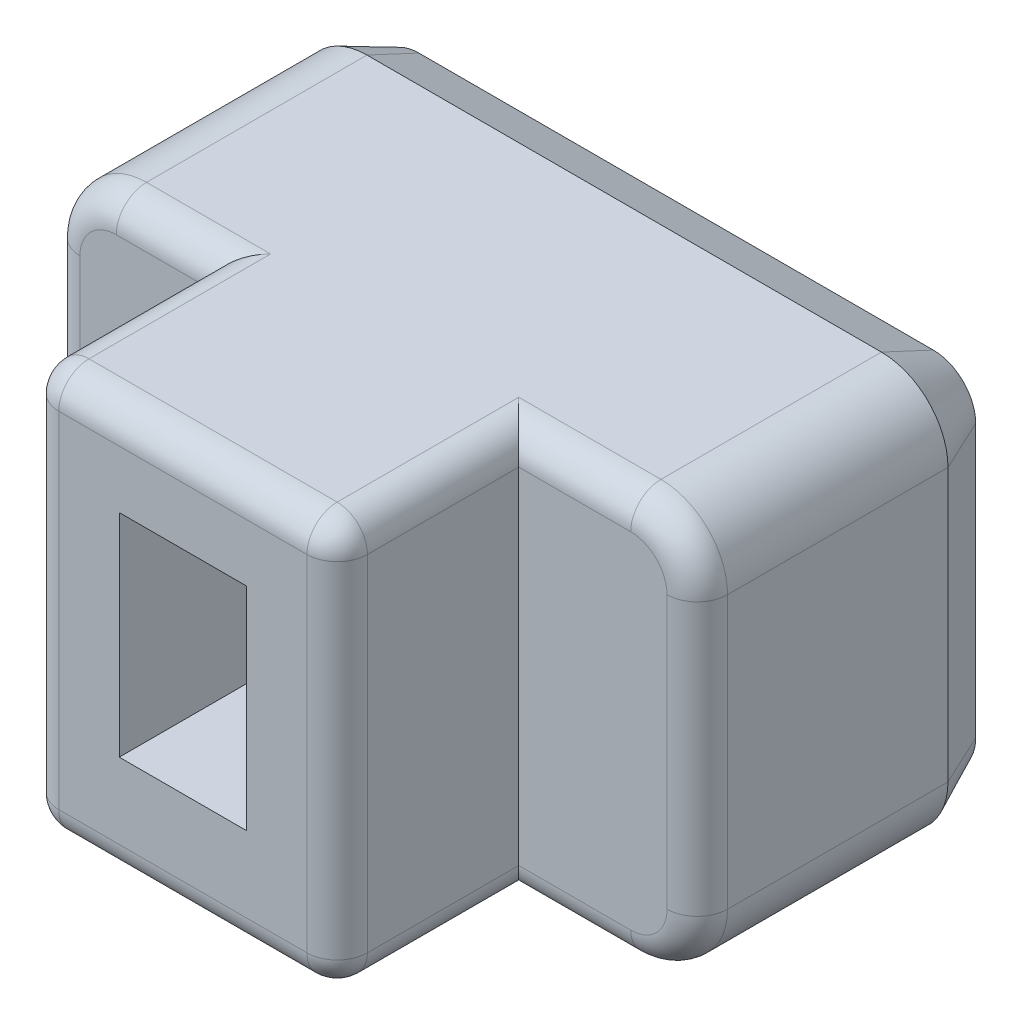
from build123d import *

# Parameters (mm, degrees)
BOSS_EXTRU_1_DEPTH      = 8
ESQUISSE3_W             = 2.1
ESQUISSE3_H             = 3.5
ENL_V_MAT_EXTRU_1_DEPTH = 3
ESQUISSE4_OUTSIDE_W     = 15.69
ESQUISSE4_OUTSIDE_H     = 11.69
ESQUISSE4_OUTSIDE_W_2   = 5.1
ESQUISSE4_OUTSIDE_H_2   = 6.7
ENL_V_MAT_EXTRU_2_DEPTH = 3
CONG_1_R                = 0.5
CHANFREIN1_SIZE         = 0.4
CHANFREIN1_SIZE2        = 0.857802768
ESQUISSE5_W             = 1.179487179
ESQUISSE5_H             = 0.41025641
ENL_V_MAT_EXTRU_3_DEPTH = 0.3
BOSS_EXTRU_2_START      = -0.2
BOSS_EXTRU_2_DEPTH      = 0.2
BOSS_EXTRU_2_2_DEPTH    = 0.2
ESQUISSE5_3_W           = 1.179487179
ESQUISSE5_3_H           = 0.41025641
BOSS_EXTRU_2_3_DEPTH    = 0.2


with BuildPart() as part:
    # Esquisse2 → Boss.-Extru.1 (new body)
    with BuildSketch(Plane.XY):
        with BuildLine():
            Line((1.1, 0), (9.6, 0))
            ThreePointArc((9.6, 0), (10.377817459, 0.322182541), (10.7, 1.1))
            Line((10.7, 1.1), (10.7, 5.6))
            ThreePointArc((10.7, 5.6), (10.377817459, 6.377817459), (9.6, 6.7))
            Line((9.6, 6.7), (1.1, 6.7))
            ThreePointArc((1.1, 6.7), (0.322182541, 6.377817459), (0, 5.6))
            Line((0, 5.6), (0, 1.1))
            ThreePointArc((0, 1.1), (0.322182541, 0.322182541), (1.1, 0))
        make_face()
    extrude(amount=BOSS_EXTRU_1_DEPTH)

    # Esquisse3 → Enlèv. mat.-Extru.1 (cut)
    with BuildSketch(Plane.XY.offset(8)):
        with Locations((5.2, 3.5)):
            Rectangle(ESQUISSE3_W, ESQUISSE3_H)
    extrude(amount=-ENL_V_MAT_EXTRU_1_DEPTH, mode=Mode.SUBTRACT)

    # Esquisse4 outside → Enlèv. mat.-Extru.2 (cut)
    with BuildSketch(Plane.XY.offset(8)):
        with Locations((5.35, 3.35)):
            Rectangle(ESQUISSE4_OUTSIDE_W, ESQUISSE4_OUTSIDE_H)
        with Locations((5.2, 3.35)):
            Rectangle(ESQUISSE4_OUTSIDE_W_2, ESQUISSE4_OUTSIDE_H_2, mode=Mode.SUBTRACT)
    extrude(amount=-ENL_V_MAT_EXTRU_2_DEPTH, mode=Mode.SUBTRACT)

    # Congé1
    cong_1_edges = [part.edges().sort_by_distance(p)[0] for p in [
        (8.675, 0, 5),
        (10.377817459, 0.322182541, 5),
        (10.7, 3.35, 5),
        (10.377817459, 6.377817459, 5),
        (1.875, 6.7, 5),
        (0.322182541, 6.377817459, 5),
        (1.875, 0, 5),
        (0.322182541, 0.322182541, 5),
        (7.75, 6.7, 6.5),
        (2.65, 6.7, 6.5),
        (7.75, 0, 6.5),
        (2.65, 0, 6.5),
        (2.65, 3.35, 8),
        (5.2, 6.7, 8),
        (7.75, 3.35, 8),
        (5.2, 0, 8),
        (8.675, 6.7, 5),
        (0, 3.35, 5),
    ]]
    fillet(cong_1_edges, radius=CONG_1_R)

    # Chanfrein1
    chanfrein1_edges = [part.edges().sort_by_distance(p)[0] for p in [
        (5.35, 0, 0),
        (10.377817459, 0.322182541, 0),
        (0.322182541, 0.322182541, 0),
        (10.7, 3.35, 0),
        (0, 3.35, 0),
        (10.377817459, 6.377817459, 0),
        (0.322182541, 6.377817459, 0),
        (5.35, 6.7, 0),
    ]]
    chanfrein1_side = [part.faces().sort_by_distance(p)[0] for p in [
        (5.35, 3.35, 0),
    ]]
    chamfer(chanfrein1_edges, length=CHANFREIN1_SIZE, length2=CHANFREIN1_SIZE2, reference=chanfrein1_side[0])

    # Esquisse5 → Enlèv. mat.-Extru.3 (cut)
    with BuildSketch(Plane.XY.offset(0.2)):
        Polygon((2.203105905, 1.356639893), (2.538041802, 1.356639893), (3.562080264, 4.427953995), (4.586118725, 1.356639893), (4.921054623, 1.356639893), (3.587721289, 5.356639893), (3.536439238, 5.356639893), align=None)
        with BuildLine():
            Line((5.126182828, 4.585005277), (5.38900334, 4.382280918))
            add(Edge.make_bspline(
                [(5.38900334, 4.382280918), (5.413090347, 4.434734124), (5.458847361, 4.534377142), (5.535673468, 4.670679709), (5.615678085, 4.785984982), (5.698107333, 4.881707379), (5.785033694, 4.955475471), (5.874475773, 5.00936547), (5.967884233, 5.042884236), (6.03190811, 5.046936478), (6.063682828, 5.048947585)],
                knots=[0, 0, 0, 0, 1.383800419, 2.628744027, 3.746436854, 4.744875104, 5.649467572, 6.46786177, 7.239607766, 8, 8, 8, 8], degree=3))
            add(Edge.make_bspline(
                [(6.063682828, 5.048947585), (6.090484232, 5.047915361), (6.144138999, 5.045848911), (6.2231394, 5.027605196), (6.29923293, 4.997330479), (6.371745345, 4.956651043), (6.438844589, 4.906290216), (6.499018233, 4.847465011), (6.549483208, 4.779569393), (6.590810957, 4.704944558), (6.623893696, 4.625687294), (6.646610538, 4.542959539), (6.662064747, 4.457906397), (6.663777523, 4.400245429), (6.664644366, 4.37106297)],
                knots=[0, 0, 0, 0, 0.957467278, 1.916790714, 2.8816612, 3.878022564, 4.880909137, 5.873739163, 6.876625736, 7.894321194, 8.917782173, 9.939815978, 10.957332139, 12, 12, 12, 12], degree=3))
            add(Edge.make_bspline(
                [(6.664644366, 4.37106297), (6.663116159, 4.33784798), (6.660045133, 4.271100414), (6.639283168, 4.171546978), (6.604732006, 4.072903182), (6.571727112, 4.0103738), (6.554868725, 3.978434764)],
                knots=[0, 0, 0, 0, 0.967036425, 1.943319252, 2.949479453, 4, 4, 4, 4], degree=3))
            add(Edge.make_bspline(
                [(6.554868725, 3.978434764), (6.541270867, 3.955544534), (6.512871237, 3.907737439), (6.462555159, 3.836879973), (6.405716133, 3.762024308), (6.34027677, 3.684373105), (6.267574529, 3.602645186), (6.186436737, 3.518095187), (6.098337308, 3.429587963), (6.035816293, 3.370878839), (6.003586674, 3.340614252)],
                knots=[0, 0, 0, 0, 0.755113658, 1.577082841, 2.46375137, 3.42141287, 4.457284934, 5.566821384, 6.745695014, 8, 8, 8, 8], degree=3))
            add(Edge.make_bspline(
                [(6.003586674, 3.340614252), (5.971383421, 3.310591476), (5.909614978, 3.253005365), (5.823584769, 3.168051464), (5.74630771, 3.090394511), (5.678749178, 3.019250278), (5.621397188, 2.954050532), (5.57160066, 2.896943255), (5.533217709, 2.844749229), (5.51173285, 2.811589806), (5.50198411, 2.796543739)],
                knots=[0, 0, 0, 0, 1.424520873, 2.732346164, 3.911797783, 4.969453705, 5.906063081, 6.721610001, 7.419931359, 8, 8, 8, 8], degree=3))
            add(Edge.make_bspline(
                [(5.50198411, 2.796543739), (5.475764473, 2.749380501), (5.423847512, 2.655993551), (5.370463251, 2.504916726), (5.336950757, 2.348246373), (5.333201387, 2.241425992), (5.331311033, 2.18756938)],
                knots=[0, 0, 0, 0, 1.009954538, 1.999790066, 2.991535804, 4, 4, 4, 4], degree=3))
            add(Edge.make_bspline(
                [(5.331311033, 2.18756938), (5.332565906, 2.145300123), (5.335040178, 2.061956491), (5.353892012, 1.939999856), (5.38417953, 1.823489004), (5.42729507, 1.714000288), (5.481866362, 1.613028432), (5.545701317, 1.521412424), (5.621269329, 1.442361638), (5.70512133, 1.374850896), (5.796225656, 1.321404354), (5.892026548, 1.28180717), (5.992382914, 1.259085711), (6.060636614, 1.25575128), (6.094932828, 1.25407579)],
                knots=[0, 0, 0, 0, 1.133761159, 2.235472776, 3.302779566, 4.358109397, 5.384199343, 6.376419921, 7.344643441, 8.308294326, 9.255929822, 10.168867226, 11.079889886, 12, 12, 12, 12], degree=3))
            add(Edge.make_bspline(
                [(6.094932828, 1.25407579), (6.131707349, 1.255659498), (6.204953393, 1.258813865), (6.312299116, 1.287922739), (6.416036266, 1.333017399), (6.4981574, 1.386290499), (6.562343254, 1.438686688), (6.611375583, 1.486881802), (6.661967328, 1.541794347), (6.711909756, 1.60583863), (6.764211933, 1.675872068), (6.816239425, 1.754194824), (6.869008346, 1.839799037), (6.903342656, 1.900068201), (6.921054623, 1.931159123)],
                knots=[0, 0, 0, 0, 1.174951508, 2.340222187, 3.534605894, 4.784307204, 5.458577557, 6.18406604, 6.982816435, 7.846623665, 8.781884822, 9.780080324, 10.854814883, 12, 12, 12, 12], degree=3))
            Line((6.921054623, 1.931159123), (6.668650776, 2.177152713))
            add(Edge.make_bspline(
                [(6.668650776, 2.177152713), (6.654201435, 2.151898252), (6.626391438, 2.103292126), (6.582472349, 2.035632698), (6.542393686, 1.973253591), (6.501535704, 1.919142288), (6.464668025, 1.869917096), (6.428269503, 1.828153302), (6.394233324, 1.792560002), (6.350737392, 1.755500881), (6.295622788, 1.719432878), (6.226757018, 1.687223386), (6.154433342, 1.668221522), (6.105188655, 1.665630625), (6.080509751, 1.6643322)],
                knots=[0, 0, 0, 0, 1.276827984, 2.457453407, 3.54024844, 4.529789216, 5.432604881, 6.238830133, 6.960111447, 7.592115036, 8.743207621, 9.839626427, 10.917331914, 12, 12, 12, 12], degree=3))
            add(Edge.make_bspline(
                [(6.080509751, 1.6643322), (6.049276014, 1.665746122), (5.988374155, 1.668503091), (5.902600694, 1.698267748), (5.825331953, 1.744298704), (5.759529383, 1.808773895), (5.706549611, 1.886571818), (5.665947342, 1.973399307), (5.643774522, 2.069762465), (5.640623659, 2.136449115), (5.63900334, 2.170742457)],
                knots=[0, 0, 0, 0, 0.995603803, 1.941302263, 2.868878109, 3.853865766, 4.861170307, 5.866733861, 6.902976476, 8, 8, 8, 8], degree=3))
            add(Edge.make_bspline(
                [(5.63900334, 2.170742457), (5.640870112, 2.213681361), (5.644590132, 2.299248109), (5.67348492, 2.404397616), (5.708611825, 2.486952831), (5.743265932, 2.552399891), (5.78794125, 2.619727979), (5.822209554, 2.664278317), (5.840125135, 2.68756938)],
                knots=[0, 0, 0, 0, 1.362911816, 2.715950407, 3.435017459, 4.213622072, 5.066075735, 6, 6, 6, 6], degree=3))
            add(Edge.make_bspline(
                [(5.840125135, 2.68756938), (5.846704061, 2.695404999), (5.862396229, 2.714094654), (5.892411835, 2.74373589), (5.930430937, 2.782089127), (5.977321107, 2.827887601), (6.032644993, 2.882096229), (6.097896134, 2.942619215), (6.171507289, 3.011641084), (6.223655606, 3.060183018), (6.251182828, 3.085806559)],
                knots=[0, 0, 0, 0, 0.428692003, 1.022523547, 1.766726267, 2.693054975, 3.769890224, 5.013497286, 6.423532597, 8, 8, 8, 8], degree=3))
            add(Edge.make_bspline(
                [(6.251182828, 3.085806559), (6.284445008, 3.117441644), (6.349046696, 3.178883192), (6.440749361, 3.270789687), (6.523315408, 3.361087254), (6.598737639, 3.447722523), (6.665419019, 3.532521955), (6.72516711, 3.613700668), (6.775556593, 3.693202952), (6.831992902, 3.79391012), (6.88788791, 3.91940785), (6.936287527, 4.071467319), (6.966684524, 4.224021852), (6.970462577, 4.326057399), (6.972336674, 4.376671944)],
                knots=[0, 0, 0, 0, 1.084389401, 2.106097175, 3.066173385, 3.974339943, 4.818837423, 5.613947617, 6.354352105, 7.040737217, 8.339964108, 9.591128425, 10.805083687, 12, 12, 12, 12], degree=3))
            add(Edge.make_bspline(
                [(6.972336674, 4.376671944), (6.971556494, 4.412490469), (6.97001493, 4.483264539), (6.958092563, 4.587658095), (6.936637494, 4.688176273), (6.909255915, 4.785610943), (6.871723611, 4.878925265), (6.827019735, 4.968900667), (6.773582783, 5.05501734), (6.713500631, 5.136655479), (6.647530402, 5.211754342), (6.576743461, 5.277875744), (6.50257859, 5.334156291), (6.424471776, 5.379698741), (6.342986155, 5.415223765), (6.257786677, 5.44091678), (6.168969827, 5.456695362), (6.108619199, 5.458361563), (6.078105905, 5.459203995)],
                knots=[0, 0, 0, 0, 1.104658156, 2.182701625, 3.23448937, 4.272148491, 5.300148647, 6.331707503, 7.367369959, 8.421864184, 9.454902215, 10.445791729, 11.404694568, 12.3202605, 13.227823242, 14.139973149, 15.059569905, 16, 16, 16, 16], degree=3))
            add(Edge.make_bspline(
                [(6.078105905, 5.459203995), (6.054565139, 5.45860577), (6.007555007, 5.457411134), (5.938180556, 5.447253257), (5.869830876, 5.432373429), (5.803800441, 5.409585404), (5.739049483, 5.381495921), (5.676353339, 5.346769713), (5.615303801, 5.305673892), (5.555672568, 5.258138126), (5.497387716, 5.203042152), (5.440800922, 5.139422589), (5.384712535, 5.068095377), (5.32979477, 4.988260237), (5.277558672, 4.899120172), (5.225534788, 4.802054625), (5.173831992, 4.697024102), (5.142384714, 4.623094429), (5.126182828, 4.585005277)],
                knots=[0, 0, 0, 0, 0.820398924, 1.638309618, 2.440372394, 3.256159469, 4.069390881, 4.898884307, 5.751274568, 6.632679565, 7.555005562, 8.544212762, 9.598733613, 10.717275191, 11.919963767, 13.199151059, 14.556980458, 16, 16, 16, 16], degree=3))
        make_face()
        with Locations((7.921054623, 3.818178354)):
            Rectangle(ESQUISSE5_W, ESQUISSE5_H)
    extrude(amount=-ENL_V_MAT_EXTRU_3_DEPTH, mode=Mode.SUBTRACT)


with BuildPart() as body_2:
    # Esquisse5<3> → Boss.-Extru.2 (new body)
    with BuildSketch(Plane.XY.offset(0.2).offset(BOSS_EXTRU_2_START)):
        Polygon((2.203105905, 1.356639893), (2.538041802, 1.356639893), (3.562080264, 4.427953995), (4.586118725, 1.356639893), (4.921054623, 1.356639893), (3.587721289, 5.356639893), (3.536439238, 5.356639893), align=None)
    extrude(amount=-BOSS_EXTRU_2_DEPTH)


with BuildPart() as body_3:
    # Esquisse5<3> → Boss.-Extru.2 2 (new body)
    with BuildSketch(Plane.XY.offset(0.2).offset(BOSS_EXTRU_2_START)):
        with BuildLine():
            Line((5.126182828, 4.585005277), (5.38900334, 4.382280918))
            add(Edge.make_bspline(
                [(5.38900334, 4.382280918), (5.413090347, 4.434734124), (5.458847361, 4.534377142), (5.535673468, 4.670679709), (5.615678085, 4.785984982), (5.698107333, 4.881707379), (5.785033694, 4.955475471), (5.874475773, 5.00936547), (5.967884233, 5.042884236), (6.03190811, 5.046936478), (6.063682828, 5.048947585)],
                knots=[0, 0, 0, 0, 1.383800419, 2.628744027, 3.746436854, 4.744875104, 5.649467572, 6.46786177, 7.239607766, 8, 8, 8, 8], degree=3))
            add(Edge.make_bspline(
                [(6.063682828, 5.048947585), (6.090484232, 5.047915361), (6.144138999, 5.045848911), (6.2231394, 5.027605196), (6.29923293, 4.997330479), (6.371745345, 4.956651043), (6.438844589, 4.906290216), (6.499018233, 4.847465011), (6.549483208, 4.779569393), (6.590810957, 4.704944558), (6.623893696, 4.625687294), (6.646610538, 4.542959539), (6.662064747, 4.457906397), (6.663777523, 4.400245429), (6.664644366, 4.37106297)],
                knots=[0, 0, 0, 0, 0.957467278, 1.916790714, 2.8816612, 3.878022564, 4.880909137, 5.873739163, 6.876625736, 7.894321194, 8.917782173, 9.939815978, 10.957332139, 12, 12, 12, 12], degree=3))
            add(Edge.make_bspline(
                [(6.664644366, 4.37106297), (6.663116159, 4.33784798), (6.660045133, 4.271100414), (6.639283168, 4.171546978), (6.604732006, 4.072903182), (6.571727112, 4.0103738), (6.554868725, 3.978434764)],
                knots=[0, 0, 0, 0, 0.967036425, 1.943319252, 2.949479453, 4, 4, 4, 4], degree=3))
            add(Edge.make_bspline(
                [(6.554868725, 3.978434764), (6.541270867, 3.955544534), (6.512871237, 3.907737439), (6.462555159, 3.836879973), (6.405716133, 3.762024308), (6.34027677, 3.684373105), (6.267574529, 3.602645186), (6.186436737, 3.518095187), (6.098337308, 3.429587963), (6.035816293, 3.370878839), (6.003586674, 3.340614252)],
                knots=[0, 0, 0, 0, 0.755113658, 1.577082841, 2.46375137, 3.42141287, 4.457284934, 5.566821384, 6.745695014, 8, 8, 8, 8], degree=3))
            add(Edge.make_bspline(
                [(6.003586674, 3.340614252), (5.971383421, 3.310591476), (5.909614978, 3.253005365), (5.823584769, 3.168051464), (5.74630771, 3.090394511), (5.678749178, 3.019250278), (5.621397188, 2.954050532), (5.57160066, 2.896943255), (5.533217709, 2.844749229), (5.51173285, 2.811589806), (5.50198411, 2.796543739)],
                knots=[0, 0, 0, 0, 1.424520873, 2.732346164, 3.911797783, 4.969453705, 5.906063081, 6.721610001, 7.419931359, 8, 8, 8, 8], degree=3))
            add(Edge.make_bspline(
                [(5.50198411, 2.796543739), (5.475764473, 2.749380501), (5.423847512, 2.655993551), (5.370463251, 2.504916726), (5.336950757, 2.348246373), (5.333201387, 2.241425992), (5.331311033, 2.18756938)],
                knots=[0, 0, 0, 0, 1.009954538, 1.999790066, 2.991535804, 4, 4, 4, 4], degree=3))
            add(Edge.make_bspline(
                [(5.331311033, 2.18756938), (5.332565906, 2.145300123), (5.335040178, 2.061956491), (5.353892012, 1.939999856), (5.38417953, 1.823489004), (5.42729507, 1.714000288), (5.481866362, 1.613028432), (5.545701317, 1.521412424), (5.621269329, 1.442361638), (5.70512133, 1.374850896), (5.796225656, 1.321404354), (5.892026548, 1.28180717), (5.992382914, 1.259085711), (6.060636614, 1.25575128), (6.094932828, 1.25407579)],
                knots=[0, 0, 0, 0, 1.133761159, 2.235472776, 3.302779566, 4.358109397, 5.384199343, 6.376419921, 7.344643441, 8.308294326, 9.255929822, 10.168867226, 11.079889886, 12, 12, 12, 12], degree=3))
            add(Edge.make_bspline(
                [(6.094932828, 1.25407579), (6.131707349, 1.255659498), (6.204953393, 1.258813865), (6.312299116, 1.287922739), (6.416036266, 1.333017399), (6.4981574, 1.386290499), (6.562343254, 1.438686688), (6.611375583, 1.486881802), (6.661967328, 1.541794347), (6.711909756, 1.60583863), (6.764211933, 1.675872068), (6.816239425, 1.754194824), (6.869008346, 1.839799037), (6.903342656, 1.900068201), (6.921054623, 1.931159123)],
                knots=[0, 0, 0, 0, 1.174951508, 2.340222187, 3.534605894, 4.784307204, 5.458577557, 6.18406604, 6.982816435, 7.846623665, 8.781884822, 9.780080324, 10.854814883, 12, 12, 12, 12], degree=3))
            Line((6.921054623, 1.931159123), (6.668650776, 2.177152713))
            add(Edge.make_bspline(
                [(6.668650776, 2.177152713), (6.654201435, 2.151898252), (6.626391438, 2.103292126), (6.582472349, 2.035632698), (6.542393686, 1.973253591), (6.501535704, 1.919142288), (6.464668025, 1.869917096), (6.428269503, 1.828153302), (6.394233324, 1.792560002), (6.350737392, 1.755500881), (6.295622788, 1.719432878), (6.226757018, 1.687223386), (6.154433342, 1.668221522), (6.105188655, 1.665630625), (6.080509751, 1.6643322)],
                knots=[0, 0, 0, 0, 1.276827984, 2.457453407, 3.54024844, 4.529789216, 5.432604881, 6.238830133, 6.960111447, 7.592115036, 8.743207621, 9.839626427, 10.917331914, 12, 12, 12, 12], degree=3))
            add(Edge.make_bspline(
                [(6.080509751, 1.6643322), (6.049276014, 1.665746122), (5.988374155, 1.668503091), (5.902600694, 1.698267748), (5.825331953, 1.744298704), (5.759529383, 1.808773895), (5.706549611, 1.886571818), (5.665947342, 1.973399307), (5.643774522, 2.069762465), (5.640623659, 2.136449115), (5.63900334, 2.170742457)],
                knots=[0, 0, 0, 0, 0.995603803, 1.941302263, 2.868878109, 3.853865766, 4.861170307, 5.866733861, 6.902976476, 8, 8, 8, 8], degree=3))
            add(Edge.make_bspline(
                [(5.63900334, 2.170742457), (5.640870112, 2.213681361), (5.644590132, 2.299248109), (5.67348492, 2.404397616), (5.708611825, 2.486952831), (5.743265932, 2.552399891), (5.78794125, 2.619727979), (5.822209554, 2.664278317), (5.840125135, 2.68756938)],
                knots=[0, 0, 0, 0, 1.362911816, 2.715950407, 3.435017459, 4.213622072, 5.066075735, 6, 6, 6, 6], degree=3))
            add(Edge.make_bspline(
                [(5.840125135, 2.68756938), (5.846704061, 2.695404999), (5.862396229, 2.714094654), (5.892411835, 2.74373589), (5.930430937, 2.782089127), (5.977321107, 2.827887601), (6.032644993, 2.882096229), (6.097896134, 2.942619215), (6.171507289, 3.011641084), (6.223655606, 3.060183018), (6.251182828, 3.085806559)],
                knots=[0, 0, 0, 0, 0.428692003, 1.022523547, 1.766726267, 2.693054975, 3.769890224, 5.013497286, 6.423532597, 8, 8, 8, 8], degree=3))
            add(Edge.make_bspline(
                [(6.251182828, 3.085806559), (6.284445008, 3.117441644), (6.349046696, 3.178883192), (6.440749361, 3.270789687), (6.523315408, 3.361087254), (6.598737639, 3.447722523), (6.665419019, 3.532521955), (6.72516711, 3.613700668), (6.775556593, 3.693202952), (6.831992902, 3.79391012), (6.88788791, 3.91940785), (6.936287527, 4.071467319), (6.966684524, 4.224021852), (6.970462577, 4.326057399), (6.972336674, 4.376671944)],
                knots=[0, 0, 0, 0, 1.084389401, 2.106097175, 3.066173385, 3.974339943, 4.818837423, 5.613947617, 6.354352105, 7.040737217, 8.339964108, 9.591128425, 10.805083687, 12, 12, 12, 12], degree=3))
            add(Edge.make_bspline(
                [(6.972336674, 4.376671944), (6.971556494, 4.412490469), (6.97001493, 4.483264539), (6.958092563, 4.587658095), (6.936637494, 4.688176273), (6.909255915, 4.785610943), (6.871723611, 4.878925265), (6.827019735, 4.968900667), (6.773582783, 5.05501734), (6.713500631, 5.136655479), (6.647530402, 5.211754342), (6.576743461, 5.277875744), (6.50257859, 5.334156291), (6.424471776, 5.379698741), (6.342986155, 5.415223765), (6.257786677, 5.44091678), (6.168969827, 5.456695362), (6.108619199, 5.458361563), (6.078105905, 5.459203995)],
                knots=[0, 0, 0, 0, 1.104658156, 2.182701625, 3.23448937, 4.272148491, 5.300148647, 6.331707503, 7.367369959, 8.421864184, 9.454902215, 10.445791729, 11.404694568, 12.3202605, 13.227823242, 14.139973149, 15.059569905, 16, 16, 16, 16], degree=3))
            add(Edge.make_bspline(
                [(6.078105905, 5.459203995), (6.054565139, 5.45860577), (6.007555007, 5.457411134), (5.938180556, 5.447253257), (5.869830876, 5.432373429), (5.803800441, 5.409585404), (5.739049483, 5.381495921), (5.676353339, 5.346769713), (5.615303801, 5.305673892), (5.555672568, 5.258138126), (5.497387716, 5.203042152), (5.440800922, 5.139422589), (5.384712535, 5.068095377), (5.32979477, 4.988260237), (5.277558672, 4.899120172), (5.225534788, 4.802054625), (5.173831992, 4.697024102), (5.142384714, 4.623094429), (5.126182828, 4.585005277)],
                knots=[0, 0, 0, 0, 0.820398924, 1.638309618, 2.440372394, 3.256159469, 4.069390881, 4.898884307, 5.751274568, 6.632679565, 7.555005562, 8.544212762, 9.598733613, 10.717275191, 11.919963767, 13.199151059, 14.556980458, 16, 16, 16, 16], degree=3))
        make_face()
    extrude(amount=-BOSS_EXTRU_2_2_DEPTH)


with BuildPart() as body_4:
    # Esquisse5<3> → Boss.-Extru.2 3 (new body)
    with BuildSketch(Plane.XY.offset(0.2).offset(BOSS_EXTRU_2_START)):
        with Locations((7.921054623, 3.818178354)):
            Rectangle(ESQUISSE5_3_W, ESQUISSE5_3_H)
    extrude(amount=-BOSS_EXTRU_2_3_DEPTH)


solid = Compound([part.part, body_2.part, body_3.part, body_4.part])
